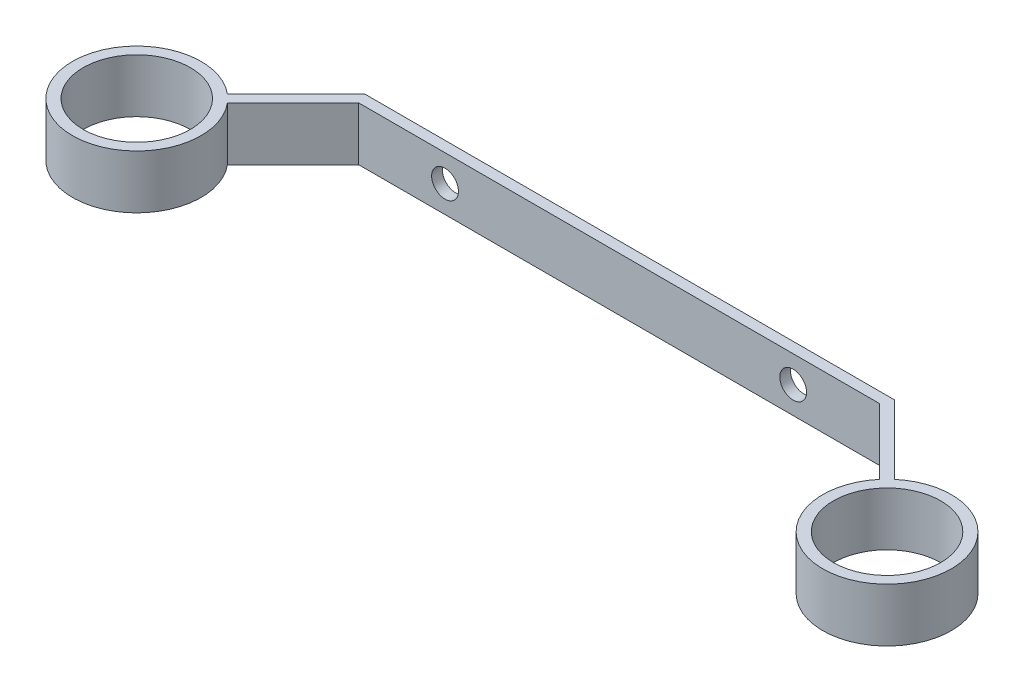
from build123d import *

# Parameters (mm, degrees)
SKETCH1_R           = 12.7
BOSS_EXTRUDE1_DEPTH = 12.7
SKETCH2_R           = 3.175
CUT_EXTRUDE1_DEPTH  = 12.7


with BuildPart() as part:
    # Sketch1 → Boss-Extrude1 (new body)
    with BuildSketch(Plane(origin=(0, 0, 0), x_dir=(1, 0, 0), z_dir=(0, 1, 0))):
        with BuildLine():
            Line((11.636850036, 9.840798811), (27.196051224, 25.4))
            Line((27.196051224, 25.4), (150.603948776, 25.4))
            Line((150.603948776, 25.4), (166.163149964, 9.840798811))
            ThreePointArc((166.163149964, 9.840798811), (188.576307345, -10.776307345), (167.959201189, 11.636850036))
            Line((167.959201189, 11.636850036), (151.656051224, 27.94))
            Line((151.656051224, 27.94), (26.143948776, 27.94))
            Line((26.143948776, 27.94), (9.840798811, 11.636850036))
            ThreePointArc((9.840798811, 11.636850036), (-10.776307345, -10.776307345), (11.636850036, 9.840798811))
        make_face()
        Circle(SKETCH1_R, mode=Mode.SUBTRACT)
        with Locations((177.8, 0)):
            Circle(SKETCH1_R, mode=Mode.SUBTRACT)
    extrude(amount=BOSS_EXTRUDE1_DEPTH)

    # Sketch2 → Cut-Extrude1 (cut)
    with BuildSketch(Plane.XY.offset(-25.4)):
        with Locations((47.64999995, 6.35)):
            Circle(SKETCH2_R)
        with Locations((130.15000005, 6.35)):
            Circle(SKETCH2_R)
    extrude(amount=-CUT_EXTRUDE1_DEPTH, mode=Mode.SUBTRACT)


solid = part.part
